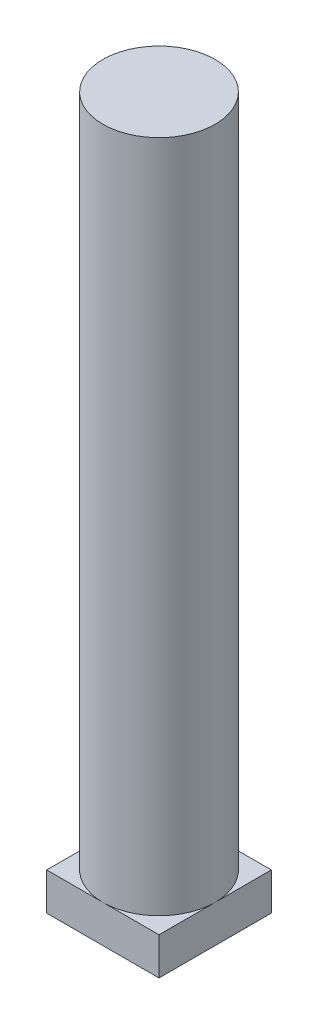
from build123d import *

# Parameters (mm, degrees)
SKETCH1_W           = 30
SKETCH1_H           = 30
BOSS_EXTRUDE1_DEPTH = 10
SKETCH2_R           = 15
BOSS_EXTRUDE2_DEPTH = 180


with BuildPart() as part:
    # Sketch1 → Boss-Extrude1 (new body)
    with BuildSketch(Plane(origin=(0, 0, 0), x_dir=(1, 0, 0), z_dir=(0, 1, 0))):
        with Locations((15, -15)):
            Rectangle(SKETCH1_W, SKETCH1_H)
    extrude(amount=BOSS_EXTRUDE1_DEPTH)

    # Sketch2 → Boss-Extrude2 (add)
    with BuildSketch(Plane(origin=(0, 10, 0), x_dir=(1, 0, 0), z_dir=(0, 1, 0))):
        with Locations(Location((15, -15, 0), (0, 0, 270))):
            Circle(SKETCH2_R)
    extrude(amount=BOSS_EXTRUDE2_DEPTH)


solid = part.part
